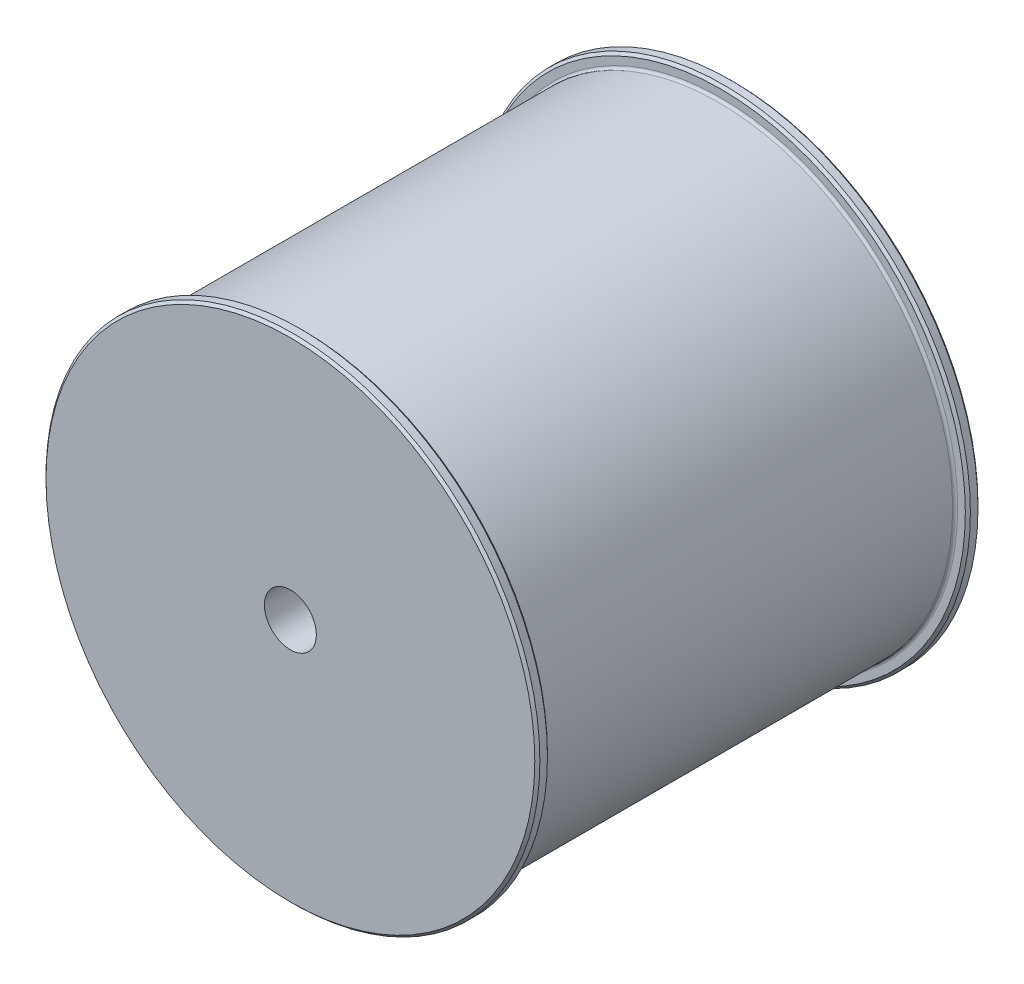
from build123d import *

# Parameters (mm, degrees)
SKETCH1_R           = 19.5
BOSS_EXTRUDE1_DEPTH = 1
SKETCH2_R           = 18.5
BOSS_EXTRUDE2_DEPTH = 33
SKETCH3_R           = 19.5
BOSS_EXTRUDE3_DEPTH = 1
FILLET1_R           = 0.2
CHAMFER1_SIZE       = 0.2
SKETCH4_R           = 2.05
CUT_EXTRUDE1_DEPTH  = 45.558949718


with BuildPart() as part:
    # Sketch1 → Boss-Extrude1 (new body)
    with BuildSketch(Plane.XY):
        Circle(SKETCH1_R)
    extrude(amount=BOSS_EXTRUDE1_DEPTH)

    # Sketch2 → Boss-Extrude2 (add)
    with BuildSketch(Plane.XY.offset(1)):
        Circle(SKETCH2_R)
    extrude(amount=BOSS_EXTRUDE2_DEPTH)

    # Sketch3 → Boss-Extrude3 (add)
    with BuildSketch(Plane.XY.offset(34)):
        Circle(SKETCH3_R)
    extrude(amount=BOSS_EXTRUDE3_DEPTH)

    # Fillet1
    fillet1_edges = [part.edges().sort_by_distance(p)[0] for p in [
        (-18.5, 0, 1),
        (-18.5, 0, 34),
    ]]
    fillet(fillet1_edges, radius=FILLET1_R)

    # Chamfer1
    chamfer1_edges = [part.edges().sort_by_distance(p)[0] for p in [
        (-19.5, 0, 35),
        (-19.5, 0, 0),
        (-19.5, 0, 1),
        (-19.5, 0, 34),
    ]]
    chamfer(chamfer1_edges, length=CHAMFER1_SIZE)

    # Sketch4 → Cut-Extrude1 (cut, through all)
    with BuildSketch(Plane.XY.offset(35)):
        Circle(SKETCH4_R)
    extrude(amount=-CUT_EXTRUDE1_DEPTH, mode=Mode.SUBTRACT)


solid = part.part
